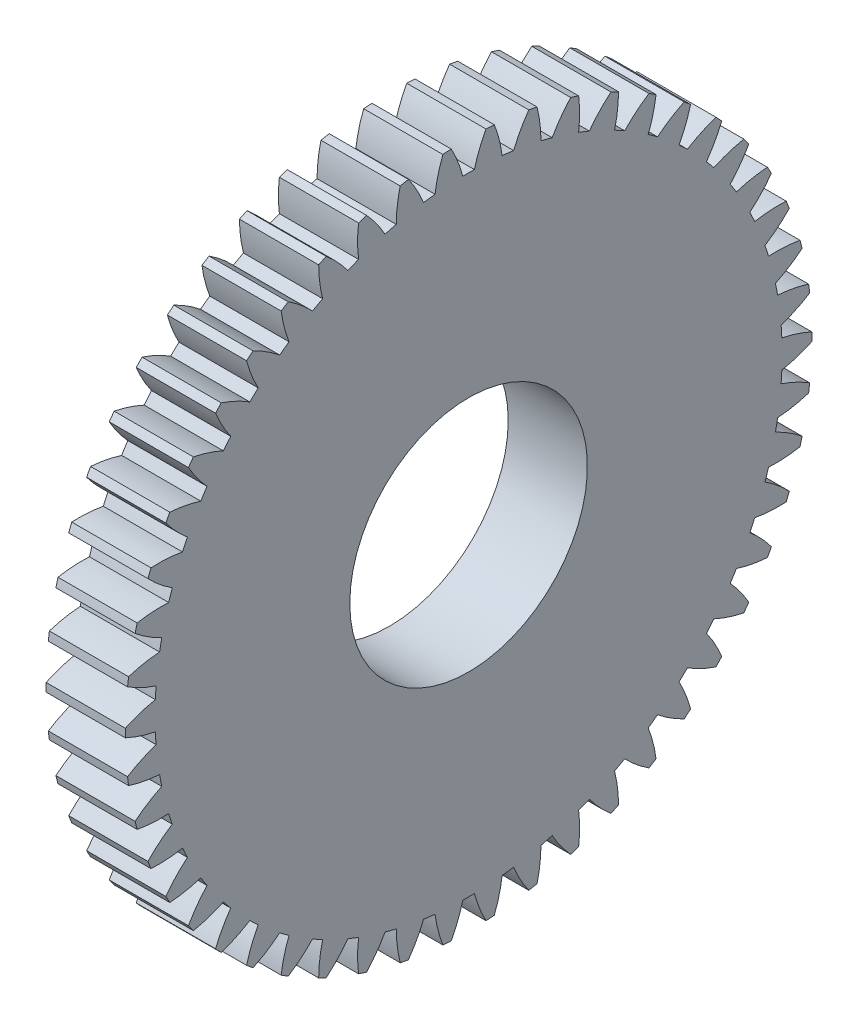
from build123d import *

# Parameters (mm, degrees)
BASPROSKE_W     = 3
BASPROSKE_H     = 13
TOOTHCUT_DEPTH  = 19.62793601
TEETHCUTS_COUNT = 50
TEETHCUTS_ANGLE = 352.8
BORSKE_R        = 4.5
BORE_DEPTH      = 50.0000508


with BuildPart() as part:
    # BasProSke → Base-Revolve (revolve)
    with BuildSketch(Plane(origin=(0, 0, 0), x_dir=(1, 0, 0), z_dir=(0, 1, 0)), mode=Mode.PRIVATE) as base_revolve_sk:
        with Locations((1.5, 6.5)):
            Rectangle(BASPROSKE_W, BASPROSKE_H)
    revolve(base_revolve_sk.sketch.rotate(Axis((-10, 0, 0), (1, 0, 0)), 180), axis=Axis((-10, 0, 0), (1, 0, 0)))

    # TooCutSke → ToothCut (cut, through all)
    with BuildSketch(Plane(origin=(0, 0, 0), x_dir=(0, 0, -1), z_dir=(1, 0, 0))):
        with BuildLine():
            ThreePointArc((0.218701072, 11.871985758), (0, 11.874), (-0.218701072, 11.871985758))
            ThreePointArc((-0.218701072, 11.871985758), (-0.410224227, 12.453928998), (-0.671481128, 13.008080498))
            ThreePointArc((-0.671481128, 13.008080498), (0, 13.0254), (0.671481128, 13.008080498))
            ThreePointArc((0.671481128, 13.008080498), (0.410224227, 12.453928998), (0.218701072, 11.871985758))
        make_face()
    toothcut = extrude(amount=TOOTHCUT_DEPTH, mode=Mode.SUBTRACT)

    # TeethCuts: ToothCut ×50 about axis
    teethcuts_axis = Axis((-10, 0, 0), (1, 0, 0))
    for i in range(1, TEETHCUTS_COUNT):
        add(toothcut.rotate(teethcuts_axis, i * TEETHCUTS_ANGLE / (TEETHCUTS_COUNT - 1)), mode=Mode.SUBTRACT)

    # BorSke → Bore (cut, symmetric)
    with BuildSketch(Plane(origin=(0, 0, 0), x_dir=(0, 0, -1), z_dir=(1, 0, 0))):
        with Locations(Location((0, 0, 0), (0, 0, 180))):
            Circle(BORSKE_R)
    extrude(amount=BORE_DEPTH, both=True, mode=Mode.SUBTRACT)


solid = part.part
